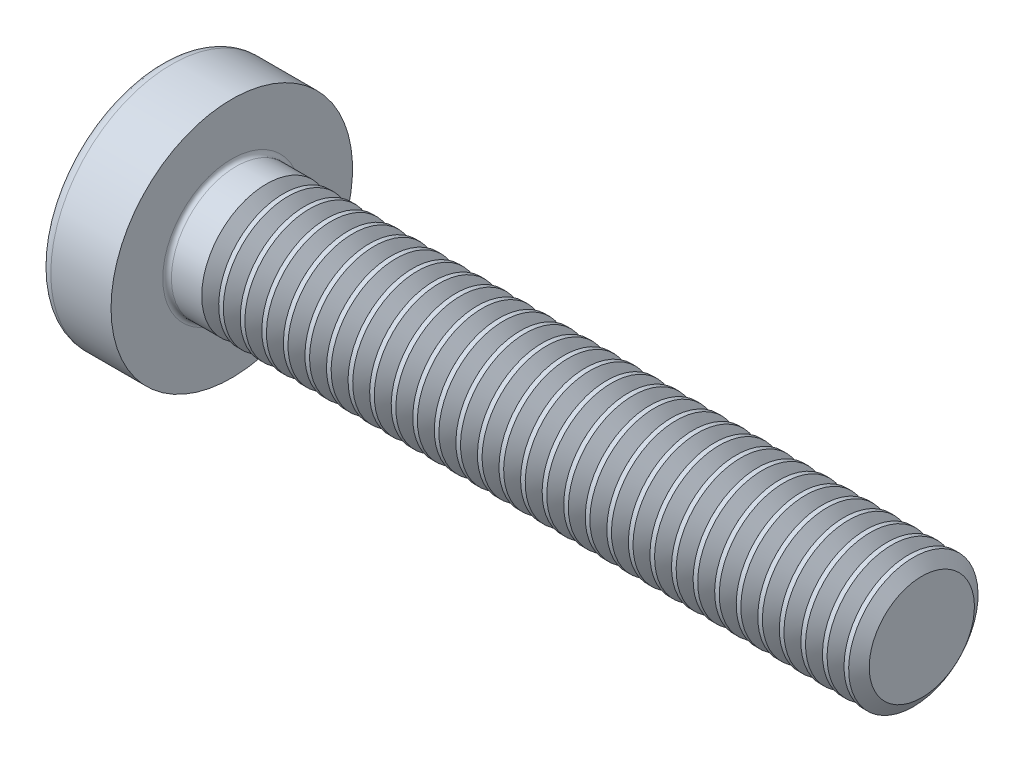
from build123d import *

# Parameters (mm, degrees)
FILLET1_R       = 0.1
RECPAT_COUNT    = 2
RECPAT_ANGLE    = 90
THDSCHPAT_COUNT = 31
THDSCHPAT_PITCH = 0.5


with BuildPart() as part:
    # BodySke → Base-Revolve (revolve)
    with BuildSketch(Plane.XY, mode=Mode.PRIVATE) as base_revolve_sk:
        with BuildLine():
            Line((2.4, 1.5), (2.4, 2.8))
            Line((2.4, 2.8), (1.003501533, 2.8))
            ThreePointArc((1.003501533, 2.8), (0.873295971, 2.76653015), (0.775371599, 2.674418605))
            ThreePointArc((0.775371599, 2.674418605), (0.197753546, 1.392274756), (0, 0))
            Line((0, 0), (18.4, 0))
            Line((18.4, 0), (18.4, 1.5))
            Line((18.4, 1.5), (2.4, 1.5))
        make_face()
    revolve(base_revolve_sk.sketch.rotate(Axis((1.003501533, 0, 0), (1, 0, 0)), 90), axis=Axis((1.003501533, 0, 0), (1, 0, 0)))

    # Fillet1
    fillet1_edges = [part.edges().sort_by_distance(p)[0] for p in [
        (2.4, 0, -1.5),
    ]]
    fillet(fillet1_edges, radius=FILLET1_R)

    # Sketch3 → Recess section 0
    with BuildSketch(Plane(origin=(0, 0, 0), x_dir=(0, 0, -1), z_dir=(1, 0, 0))):
        with BuildLine():
            Line((0.37, -1.4), (-0.37, -1.4))
            Line((-0.37, -1.4), (-0.37, 1.4))
            Line((-0.37, 1.4), (0.37, 1.4))
            Line((0.37, 1.4), (0.37, -1.4))
        make_face()
    # Sketch4 → Recess section 1
    with BuildSketch(Plane(origin=(1.75, 0, 0), x_dir=(0, 0, -1), z_dir=(1, 0, 0))):
        with BuildLine():
            Line((0.37, -0.527482332), (-0.37, -0.527482332))
            Line((-0.37, -0.527482332), (-0.37, 0.527482332))
            Line((-0.37, 0.527482332), (0.37, 0.527482332))
            Line((0.37, 0.527482332), (0.37, -0.527482332))
        make_face()
    recess = loft(mode=Mode.SUBTRACT)

    # RecPat: Recess ×2 about axis
    recpat_axis = Axis((0, 0, 0), (1, 0, 0))
    for i in range(1, RECPAT_COUNT):
        add(recess.rotate(recpat_axis, i * RECPAT_ANGLE / (RECPAT_COUNT - 1)), mode=Mode.SUBTRACT)

    # RecCorSke → RecessCore (revolve, cut)
    with BuildSketch(Plane.XY, mode=Mode.PRIVATE) as recesscore_sk:
        Polygon((0, 0), (0, 0.678371921), (1.75, 0.556), (1.930655351, 0), align=None)
    revolve(recesscore_sk.sketch.rotate(Axis((-3.175, 0, 0), (1, 0, 0)), 344.185974362), axis=Axis((-3.175, 0, 0), (1, 0, 0)), mode=Mode.SUBTRACT)

    # ThdSchSke → ThreadSchematic (revolve, cut)
    with BuildSketch(Plane.XY, mode=Mode.PRIVATE) as threadschematic_sk:
        Polygon((3.4, -1.2195), (3.203591786, -1.5), (3.203591786, -1.875), (3.596408214, -1.875), (3.596408214, -1.5), align=None)
    threadschematic = revolve(threadschematic_sk.sketch.rotate(Axis((-3.175, 0, 0), (1, 0, 0)), 270), axis=Axis((-3.175, 0, 0), (1, 0, 0)), mode=Mode.SUBTRACT)

    # ThdSchPat: ThreadSchematic ×31
    with Locations(*[(i * THDSCHPAT_PITCH, 0, 0) for i in range(1, THDSCHPAT_COUNT)]):
        add(threadschematic, mode=Mode.SUBTRACT)


solid = part.part
